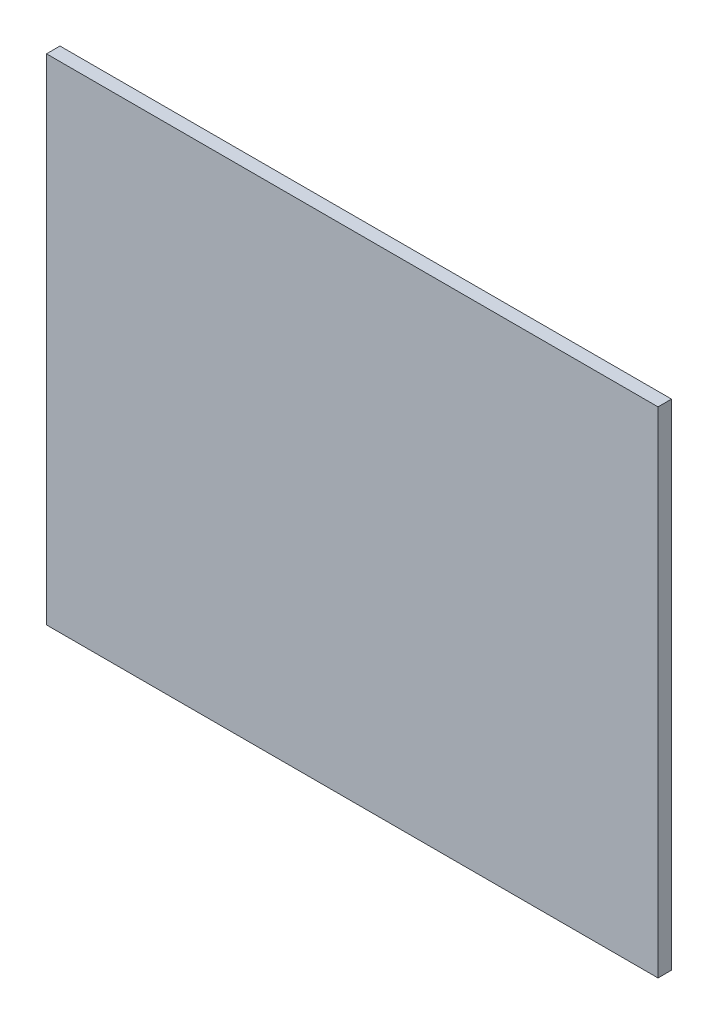
from build123d import *

# Parameters (mm, degrees)
SKETCH1_W           = 136
SKETCH1_H           = 110
BOSS_EXTRUDE1_DEPTH = 3


with BuildPart() as part:
    # Sketch1 → Boss-Extrude1 (new body)
    with BuildSketch(Plane.XY):
        Rectangle(SKETCH1_W, SKETCH1_H)
    extrude(amount=BOSS_EXTRUDE1_DEPTH)


solid = part.part
